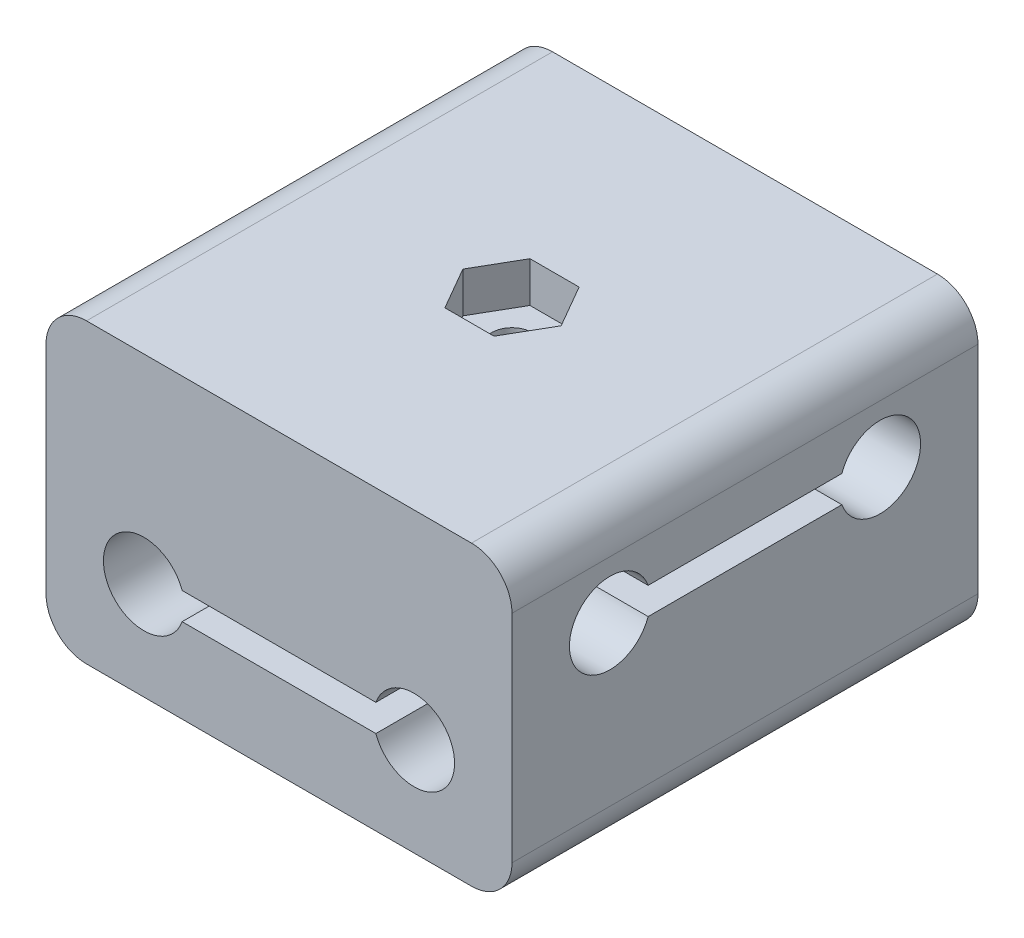
from build123d import *

# Parameters (mm, degrees)
SKETCH1_W           = 34.5
SKETCH1_H           = 22
BOSS_EXTRUDE1_DEPTH = 34.5
CUT_EXTRUDE1_DEPTH  = 51.014997751
CUT_EXTRUDE2_DEPTH  = 3
SKETCH3_3_R         = 1.5
CUT_EXTRUDE3_DEPTH  = 45.405095428
CHAMFER1_SIZE       = 2
FILLET1_R           = 3


with BuildPart() as part:
    # Sketch1 → Boss-Extrude1 (new body)
    with BuildSketch(Plane.XY):
        Rectangle(SKETCH1_W, SKETCH1_H)
        with BuildLine():
            ThreePointArc((-7.171572875, -4.75), (-13, -3.75), (-7.171572875, -2.75))
            Line((-7.171572875, -2.75), (7.171572875, -2.75))
            ThreePointArc((7.171572875, -2.75), (10.507305936, -0.793204321), (13, -3.75))
            ThreePointArc((13, -3.75), (10.507305936, -6.706795679), (7.171572875, -4.75))
            Line((7.171572875, -4.75), (-7.171572875, -4.75))
        make_face(mode=Mode.SUBTRACT)
    extrude(amount=-BOSS_EXTRUDE1_DEPTH)

    # Sketch2 → Cut-Extrude1 (cut, through all)
    with BuildSketch(Plane(origin=(17.25, 0, 0), x_dir=(0, 0, -1), z_dir=(1, 0, 0))):
        with BuildLine():
            Line((10.078427125, 2.75), (24.421572875, 2.75))
            ThreePointArc((24.421572875, 2.75), (30.25, 3.75), (24.421572875, 4.75))
            Line((24.421572875, 4.75), (10.078427125, 4.75))
            ThreePointArc((10.078427125, 4.75), (4.25, 3.75), (10.078427125, 2.75))
        make_face()
    extrude(amount=-CUT_EXTRUDE1_DEPTH, mode=Mode.SUBTRACT)

    # Sketch3 → Cut-Extrude2 (cut)
    with BuildSketch(Plane(origin=(0, 11, 0), x_dir=(1, 0, 0), z_dir=(0, 1, 0))):
        Polygon((1.818653348, 20.4), (-1.818653348, 20.4), (-3.637306696, 17.25), (-1.818653348, 14.1), (1.818653348, 14.1), (3.637306696, 17.25), align=None)
    extrude(amount=-CUT_EXTRUDE2_DEPTH, mode=Mode.SUBTRACT)

    # Sketch3<3> → Cut-Extrude3 (cut, through all)
    with BuildSketch(Plane(origin=(0, 11, 0), x_dir=(1, 0, 0), z_dir=(0, 1, 0))):
        with Locations((0, 17.25)):
            Circle(SKETCH3_3_R)
    extrude(amount=-CUT_EXTRUDE3_DEPTH, mode=Mode.SUBTRACT)

    # Chamfer1
    chamfer1_edges = [part.edges().sort_by_distance(p)[0] for p in [
        (-1.5, -11, -17.25),
    ]]
    chamfer(chamfer1_edges, length=CHAMFER1_SIZE)

    # Fillet1
    fillet1_edges = [part.edges().sort_by_distance(p)[0] for p in [
        (-17.25, -11, -17.25),
        (17.25, -11, -17.25),
        (17.25, 11, -17.25),
        (-17.25, 11, -17.25),
    ]]
    fillet(fillet1_edges, radius=FILLET1_R)


solid = part.part
